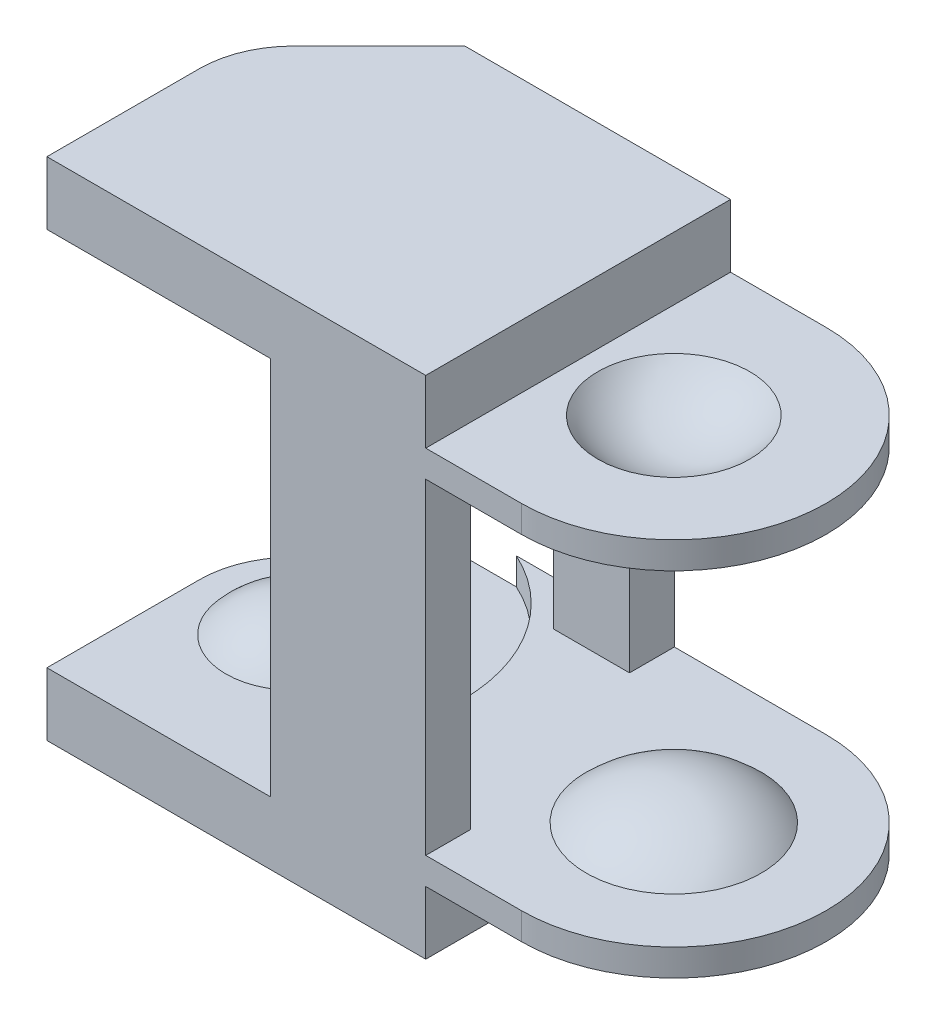
from build123d import *

# Parameters (mm, degrees)
BOSS_EXTRUDE2_DEPTH = 2.1082
BOSS_EXTRUDE3_DEPTH = 0.9
SKETCH13_W          = 5.200208993
SKETCH13_H          = 1.5
BOSS_EXTRUDE4_DEPTH = 6.35
SKETCH16_W          = 2.54
SKETCH16_H          = 1.5
BOSS_EXTRUDE5_DEPTH = 5.45


with BuildPart() as part:
    # Sketch6 → Boss-Extrude2 (new body)
    with BuildSketch(Plane(origin=(0, 0, 0), x_dir=(1, 0, 0), z_dir=(0, 1, 0))):
        with BuildLine():
            Line((3.1496, 3.175), (3.1496, 8.27377964))
            Line((3.1496, 8.27377964), (-5.741348421, 8.27377964))
            Line((-5.741348421, 8.27377964), (-8.59506403, 5.42006403))
            ThreePointArc((-8.59506403, 5.42006403), (-9.283317516, 4.390019898), (-9.525, 3.175))
            Line((-9.525, 3.175), (-9.525, -1.92377964))
            Line((-9.525, -1.92377964), (-6.989909723, -1.92377964))
            Line((-6.989909723, -1.92377964), (3.1496, -1.92377964))
            Line((3.1496, -1.92377964), (3.1496, 3.175))
        make_face()
    extrude(amount=BOSS_EXTRUDE2_DEPTH)

    # Sketch7 → Boss-Extrude3 (add)
    with BuildSketch(Plane.XZ):
        with BuildLine():
            Line((-2.050608993, 1.92377964), (-2.050608993, 0.42377964))
            ThreePointArc((-2.050608993, 0.42377964), (-0.881374643, -4.411978027), (-4.017957094, -8.27377964))
            Line((-4.017957094, -8.27377964), (6.35, -8.27377964))
            ThreePointArc((6.35, -8.27377964), (11.44877964, -3.175), (6.35, 1.92377964))
            Line((6.35, 1.92377964), (-2.050608993, 1.92377964))
        make_face()
    extrude(amount=BOSS_EXTRUDE3_DEPTH)

    # Sketch10 → Revolve2 (revolve)
    with BuildSketch(Plane.XY.offset(-3.175), mode=Mode.PRIVATE) as revolve2_sk:
        with BuildLine():
            Line((-6.35, 0), (-6.35, -1.065979307))
            ThreePointArc((-6.35, -1.065979307), (-5.088839039, -0.786386653), (-4.064, 0))
            Line((-4.064, 0), (-6.35, 0))
        make_face()
    revolve(revolve2_sk.sketch.rotate(Axis((-6.35, 0, -3.175), (0, -1, 0)), 180), axis=Axis((-6.35, 0, -3.175), (0, -1, 0)))

    # Sketch11 → Revolve4 (revolve)
    with BuildSketch(Plane.XY.offset(-3.175), mode=Mode.PRIVATE) as revolve4_sk:
        with BuildLine():
            Line((6.35, -0.9), (6.35, -2.083581452))
            ThreePointArc((6.35, -2.083581452), (7.929346537, -1.776499661), (9.278562256, -0.9))
            Line((9.278562256, -0.9), (6.35, -0.9))
        make_face()
    revolve(revolve4_sk.sketch.rotate(Axis((6.35, -0.9, -3.175), (0, -1, 0)), 180), axis=Axis((6.35, -0.9, -3.175), (0, -1, 0)))

    # Sketch12 → Cut-Revolve1 (revolve, cut)
    with BuildSketch(Plane.XY.offset(-3.175), mode=Mode.PRIVATE) as cut_revolve1_sk:
        with BuildLine():
            Line((8.89, 0), (6.35, 0))
            Line((6.35, 0), (6.35, -1.184421452))
            ThreePointArc((6.35, -1.184421452), (7.751289957, -0.873762947), (8.89, 0))
        make_face()
    revolve(cut_revolve1_sk.sketch.rotate(Axis((6.35, 0, -3.175), (0, -1, 0)), 180), axis=Axis((6.35, 0, -3.175), (0, -1, 0)), mode=Mode.SUBTRACT)

    # Sketch13 → Boss-Extrude4 (add)
    with BuildSketch(Plane.XZ):
        with Locations((0.549495504, 1.17377964)):
            Rectangle(SKETCH13_W, SKETCH13_H)
    extrude(amount=BOSS_EXTRUDE4_DEPTH)

    # Sketch16 → Boss-Extrude5 (add)
    with BuildSketch(Plane.XZ.offset(0.9)):
        with Locations((0, -7.52377964)):
            Rectangle(SKETCH16_W, SKETCH16_H)
    extrude(amount=BOSS_EXTRUDE5_DEPTH)

    # Mirror1: part across plane


with BuildPart() as part_1:
    add(part.part)
    add(part.part.mirror(Plane(origin=(3.1496, -6.35, 1.92377964), x_dir=(0, 0, 1), z_dir=(0, 1, 0))))


solid = part_1.part
